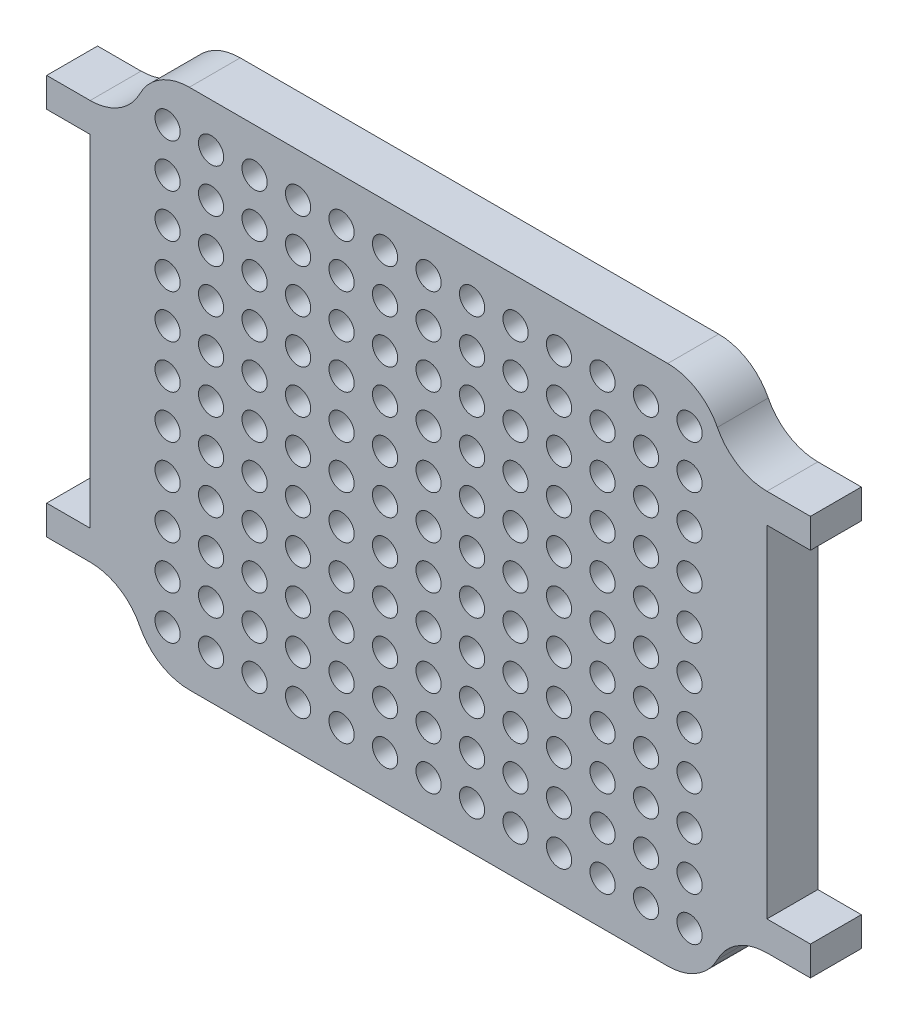
from build123d import *

# Parameters (mm, degrees)
SKETCH1_R           = 1.45
BOSS_EXTRUDE1_DEPTH = 5.85


with BuildPart() as part:
    # Sketch1 → Boss-Extrude1 (new body)
    with BuildSketch(Plane.XY):
        with BuildLine():
            Line((-38.9, 19.6), (-38.9, -19.6))
            Line((-38.9, -19.6), (-43.9, -19.6))
            Line((-43.9, -19.6), (-43.9, -22.98))
            Line((-43.9, -22.98), (-38.9, -22.98))
            ThreePointArc((-38.9, -22.98), (-35.552982671, -23.927877842), (-33.2, -26.49))
            ThreePointArc((-33.2, -26.49), (-30.847017329, -29.052122158), (-27.5, -30))
            Line((-27.5, -30), (27.5, -30))
            ThreePointArc((27.5, -30), (30.847017329, -29.052122158), (33.2, -26.49))
            ThreePointArc((33.2, -26.49), (35.552982671, -23.927877842), (38.9, -22.98))
            Line((38.9, -22.98), (43.9, -22.98))
            Line((43.9, -22.98), (43.9, -19.6))
            Line((43.9, -19.6), (38.9, -19.6))
            Line((38.9, -19.6), (38.9, 19.6))
            Line((38.9, 19.6), (43.9, 19.6))
            Line((43.9, 19.6), (43.9, 22.98))
            Line((43.9, 22.98), (38.9, 22.98))
            ThreePointArc((38.9, 22.98), (35.552982671, 23.927877842), (33.2, 26.49))
            ThreePointArc((33.2, 26.49), (30.847017329, 29.052122158), (27.5, 30))
            Line((27.5, 30), (-27.5, 30))
            ThreePointArc((-27.5, 30), (-30.847017329, 29.052122158), (-33.2, 26.49))
            ThreePointArc((-33.2, 26.49), (-35.552982671, 23.927877842), (-38.9, 22.98))
            Line((-38.9, 22.98), (-43.9, 22.98))
            Line((-43.9, 22.98), (-43.9, 19.6))
            Line((-43.9, 19.6), (-38.9, 19.6))
        make_face()
        with Locations((-30, 25)):
            Circle(SKETCH1_R, mode=Mode.SUBTRACT)
        with Locations((-25, 25)):
            Circle(SKETCH1_R, mode=Mode.SUBTRACT)
        with Locations((-20, 25)):
            Circle(SKETCH1_R, mode=Mode.SUBTRACT)
        with Locations((-15, 25)):
            Circle(SKETCH1_R, mode=Mode.SUBTRACT)
        with Locations((-10, 25)):
            Circle(SKETCH1_R, mode=Mode.SUBTRACT)
        with Locations((-5, 25)):
            Circle(SKETCH1_R, mode=Mode.SUBTRACT)
        with Locations((0, 25)):
            Circle(SKETCH1_R, mode=Mode.SUBTRACT)
        with Locations((5, 25)):
            Circle(SKETCH1_R, mode=Mode.SUBTRACT)
        with Locations((10, 25)):
            Circle(SKETCH1_R, mode=Mode.SUBTRACT)
        with Locations((15, 25)):
            Circle(SKETCH1_R, mode=Mode.SUBTRACT)
        with Locations((20, 25)):
            Circle(SKETCH1_R, mode=Mode.SUBTRACT)
        with Locations((25, 25)):
            Circle(SKETCH1_R, mode=Mode.SUBTRACT)
        with Locations((30, 25)):
            Circle(SKETCH1_R, mode=Mode.SUBTRACT)
        with Locations((-25, 20)):
            Circle(SKETCH1_R, mode=Mode.SUBTRACT)
        with Locations((-20, 20)):
            Circle(SKETCH1_R, mode=Mode.SUBTRACT)
        with Locations((-15, 20)):
            Circle(SKETCH1_R, mode=Mode.SUBTRACT)
        with Locations((-10, 20)):
            Circle(SKETCH1_R, mode=Mode.SUBTRACT)
        with Locations((-5, 20)):
            Circle(SKETCH1_R, mode=Mode.SUBTRACT)
        with Locations((0, 20)):
            Circle(SKETCH1_R, mode=Mode.SUBTRACT)
        with Locations((5, 20)):
            Circle(SKETCH1_R, mode=Mode.SUBTRACT)
        with Locations((10, 20)):
            Circle(SKETCH1_R, mode=Mode.SUBTRACT)
        with Locations((15, 20)):
            Circle(SKETCH1_R, mode=Mode.SUBTRACT)
        with Locations((20, 20)):
            Circle(SKETCH1_R, mode=Mode.SUBTRACT)
        with Locations((25, 20)):
            Circle(SKETCH1_R, mode=Mode.SUBTRACT)
        with Locations((30, 20)):
            Circle(SKETCH1_R, mode=Mode.SUBTRACT)
        with Locations((-25, 15)):
            Circle(SKETCH1_R, mode=Mode.SUBTRACT)
        with Locations((-20, 15)):
            Circle(SKETCH1_R, mode=Mode.SUBTRACT)
        with Locations((-15, 15)):
            Circle(SKETCH1_R, mode=Mode.SUBTRACT)
        with Locations((-10, 15)):
            Circle(SKETCH1_R, mode=Mode.SUBTRACT)
        with Locations((-5, 15)):
            Circle(SKETCH1_R, mode=Mode.SUBTRACT)
        with Locations((0, 15)):
            Circle(SKETCH1_R, mode=Mode.SUBTRACT)
        with Locations((5, 15)):
            Circle(SKETCH1_R, mode=Mode.SUBTRACT)
        with Locations((10, 15)):
            Circle(SKETCH1_R, mode=Mode.SUBTRACT)
        with Locations((15, 15)):
            Circle(SKETCH1_R, mode=Mode.SUBTRACT)
        with Locations((20, 15)):
            Circle(SKETCH1_R, mode=Mode.SUBTRACT)
        with Locations((25, 15)):
            Circle(SKETCH1_R, mode=Mode.SUBTRACT)
        with Locations((30, 15)):
            Circle(SKETCH1_R, mode=Mode.SUBTRACT)
        with Locations((-25, 10)):
            Circle(SKETCH1_R, mode=Mode.SUBTRACT)
        with Locations((-20, 10)):
            Circle(SKETCH1_R, mode=Mode.SUBTRACT)
        with Locations((-15, 10)):
            Circle(SKETCH1_R, mode=Mode.SUBTRACT)
        with Locations((-10, 10)):
            Circle(SKETCH1_R, mode=Mode.SUBTRACT)
        with Locations((-5, 10)):
            Circle(SKETCH1_R, mode=Mode.SUBTRACT)
        with Locations((0, 10)):
            Circle(SKETCH1_R, mode=Mode.SUBTRACT)
        with Locations((5, 10)):
            Circle(SKETCH1_R, mode=Mode.SUBTRACT)
        with Locations((10, 10)):
            Circle(SKETCH1_R, mode=Mode.SUBTRACT)
        with Locations((15, 10)):
            Circle(SKETCH1_R, mode=Mode.SUBTRACT)
        with Locations((20, 10)):
            Circle(SKETCH1_R, mode=Mode.SUBTRACT)
        with Locations((25, 10)):
            Circle(SKETCH1_R, mode=Mode.SUBTRACT)
        with Locations((30, 10)):
            Circle(SKETCH1_R, mode=Mode.SUBTRACT)
        with Locations((-25, 5)):
            Circle(SKETCH1_R, mode=Mode.SUBTRACT)
        with Locations((-20, 5)):
            Circle(SKETCH1_R, mode=Mode.SUBTRACT)
        with Locations((-15, 5)):
            Circle(SKETCH1_R, mode=Mode.SUBTRACT)
        with Locations((-10, 5)):
            Circle(SKETCH1_R, mode=Mode.SUBTRACT)
        with Locations((-5, 5)):
            Circle(SKETCH1_R, mode=Mode.SUBTRACT)
        with Locations((0, 5)):
            Circle(SKETCH1_R, mode=Mode.SUBTRACT)
        with Locations((5, 5)):
            Circle(SKETCH1_R, mode=Mode.SUBTRACT)
        with Locations((10, 5)):
            Circle(SKETCH1_R, mode=Mode.SUBTRACT)
        with Locations((15, 5)):
            Circle(SKETCH1_R, mode=Mode.SUBTRACT)
        with Locations((20, 5)):
            Circle(SKETCH1_R, mode=Mode.SUBTRACT)
        with Locations((25, 5)):
            Circle(SKETCH1_R, mode=Mode.SUBTRACT)
        with Locations((30, 5)):
            Circle(SKETCH1_R, mode=Mode.SUBTRACT)
        with Locations((-25, 0)):
            Circle(SKETCH1_R, mode=Mode.SUBTRACT)
        with Locations((-20, 0)):
            Circle(SKETCH1_R, mode=Mode.SUBTRACT)
        with Locations((-15, 0)):
            Circle(SKETCH1_R, mode=Mode.SUBTRACT)
        with Locations((-10, 0)):
            Circle(SKETCH1_R, mode=Mode.SUBTRACT)
        with Locations((-5, 0)):
            Circle(SKETCH1_R, mode=Mode.SUBTRACT)
        Circle(SKETCH1_R, mode=Mode.SUBTRACT)
        with Locations((5, 0)):
            Circle(SKETCH1_R, mode=Mode.SUBTRACT)
        with Locations((10, 0)):
            Circle(SKETCH1_R, mode=Mode.SUBTRACT)
        with Locations((15, 0)):
            Circle(SKETCH1_R, mode=Mode.SUBTRACT)
        with Locations((20, 0)):
            Circle(SKETCH1_R, mode=Mode.SUBTRACT)
        with Locations((25, 0)):
            Circle(SKETCH1_R, mode=Mode.SUBTRACT)
        with Locations((30, 0)):
            Circle(SKETCH1_R, mode=Mode.SUBTRACT)
        with Locations((-25, -5)):
            Circle(SKETCH1_R, mode=Mode.SUBTRACT)
        with Locations((-20, -5)):
            Circle(SKETCH1_R, mode=Mode.SUBTRACT)
        with Locations((-15, -5)):
            Circle(SKETCH1_R, mode=Mode.SUBTRACT)
        with Locations((-10, -5)):
            Circle(SKETCH1_R, mode=Mode.SUBTRACT)
        with Locations((-5, -5)):
            Circle(SKETCH1_R, mode=Mode.SUBTRACT)
        with Locations((0, -5)):
            Circle(SKETCH1_R, mode=Mode.SUBTRACT)
        with Locations((5, -5)):
            Circle(SKETCH1_R, mode=Mode.SUBTRACT)
        with Locations((10, -5)):
            Circle(SKETCH1_R, mode=Mode.SUBTRACT)
        with Locations((15, -5)):
            Circle(SKETCH1_R, mode=Mode.SUBTRACT)
        with Locations((20, -5)):
            Circle(SKETCH1_R, mode=Mode.SUBTRACT)
        with Locations((25, -5)):
            Circle(SKETCH1_R, mode=Mode.SUBTRACT)
        with Locations((30, -5)):
            Circle(SKETCH1_R, mode=Mode.SUBTRACT)
        with Locations((-25, -10)):
            Circle(SKETCH1_R, mode=Mode.SUBTRACT)
        with Locations((-20, -10)):
            Circle(SKETCH1_R, mode=Mode.SUBTRACT)
        with Locations((-15, -10)):
            Circle(SKETCH1_R, mode=Mode.SUBTRACT)
        with Locations((-10, -10)):
            Circle(SKETCH1_R, mode=Mode.SUBTRACT)
        with Locations((-5, -10)):
            Circle(SKETCH1_R, mode=Mode.SUBTRACT)
        with Locations((0, -10)):
            Circle(SKETCH1_R, mode=Mode.SUBTRACT)
        with Locations((5, -10)):
            Circle(SKETCH1_R, mode=Mode.SUBTRACT)
        with Locations((10, -10)):
            Circle(SKETCH1_R, mode=Mode.SUBTRACT)
        with Locations((15, -10)):
            Circle(SKETCH1_R, mode=Mode.SUBTRACT)
        with Locations((20, -10)):
            Circle(SKETCH1_R, mode=Mode.SUBTRACT)
        with Locations((25, -10)):
            Circle(SKETCH1_R, mode=Mode.SUBTRACT)
        with Locations((30, -10)):
            Circle(SKETCH1_R, mode=Mode.SUBTRACT)
        with Locations((-25, -15)):
            Circle(SKETCH1_R, mode=Mode.SUBTRACT)
        with Locations((-20, -15)):
            Circle(SKETCH1_R, mode=Mode.SUBTRACT)
        with Locations((-15, -15)):
            Circle(SKETCH1_R, mode=Mode.SUBTRACT)
        with Locations((-10, -15)):
            Circle(SKETCH1_R, mode=Mode.SUBTRACT)
        with Locations((-5, -15)):
            Circle(SKETCH1_R, mode=Mode.SUBTRACT)
        with Locations((0, -15)):
            Circle(SKETCH1_R, mode=Mode.SUBTRACT)
        with Locations((5, -15)):
            Circle(SKETCH1_R, mode=Mode.SUBTRACT)
        with Locations((10, -15)):
            Circle(SKETCH1_R, mode=Mode.SUBTRACT)
        with Locations((15, -15)):
            Circle(SKETCH1_R, mode=Mode.SUBTRACT)
        with Locations((20, -15)):
            Circle(SKETCH1_R, mode=Mode.SUBTRACT)
        with Locations((25, -15)):
            Circle(SKETCH1_R, mode=Mode.SUBTRACT)
        with Locations((30, -15)):
            Circle(SKETCH1_R, mode=Mode.SUBTRACT)
        with Locations((-25, -20)):
            Circle(SKETCH1_R, mode=Mode.SUBTRACT)
        with Locations((-20, -20)):
            Circle(SKETCH1_R, mode=Mode.SUBTRACT)
        with Locations((-15, -20)):
            Circle(SKETCH1_R, mode=Mode.SUBTRACT)
        with Locations((-10, -20)):
            Circle(SKETCH1_R, mode=Mode.SUBTRACT)
        with Locations((-5, -20)):
            Circle(SKETCH1_R, mode=Mode.SUBTRACT)
        with Locations((0, -20)):
            Circle(SKETCH1_R, mode=Mode.SUBTRACT)
        with Locations((5, -20)):
            Circle(SKETCH1_R, mode=Mode.SUBTRACT)
        with Locations((10, -20)):
            Circle(SKETCH1_R, mode=Mode.SUBTRACT)
        with Locations((15, -20)):
            Circle(SKETCH1_R, mode=Mode.SUBTRACT)
        with Locations((20, -20)):
            Circle(SKETCH1_R, mode=Mode.SUBTRACT)
        with Locations((25, -20)):
            Circle(SKETCH1_R, mode=Mode.SUBTRACT)
        with Locations((30, -20)):
            Circle(SKETCH1_R, mode=Mode.SUBTRACT)
        with Locations((-25, -25)):
            Circle(SKETCH1_R, mode=Mode.SUBTRACT)
        with Locations((-20, -25)):
            Circle(SKETCH1_R, mode=Mode.SUBTRACT)
        with Locations((-15, -25)):
            Circle(SKETCH1_R, mode=Mode.SUBTRACT)
        with Locations((-10, -25)):
            Circle(SKETCH1_R, mode=Mode.SUBTRACT)
        with Locations((-5, -25)):
            Circle(SKETCH1_R, mode=Mode.SUBTRACT)
        with Locations((0, -25)):
            Circle(SKETCH1_R, mode=Mode.SUBTRACT)
        with Locations((5, -25)):
            Circle(SKETCH1_R, mode=Mode.SUBTRACT)
        with Locations((10, -25)):
            Circle(SKETCH1_R, mode=Mode.SUBTRACT)
        with Locations((15, -25)):
            Circle(SKETCH1_R, mode=Mode.SUBTRACT)
        with Locations((20, -25)):
            Circle(SKETCH1_R, mode=Mode.SUBTRACT)
        with Locations((25, -25)):
            Circle(SKETCH1_R, mode=Mode.SUBTRACT)
        with Locations((30, -25)):
            Circle(SKETCH1_R, mode=Mode.SUBTRACT)
        with Locations((-30, 20)):
            Circle(SKETCH1_R, mode=Mode.SUBTRACT)
        with Locations((-30, 15)):
            Circle(SKETCH1_R, mode=Mode.SUBTRACT)
        with Locations((-30, 10)):
            Circle(SKETCH1_R, mode=Mode.SUBTRACT)
        with Locations((-30, 5)):
            Circle(SKETCH1_R, mode=Mode.SUBTRACT)
        with Locations((-30, 0)):
            Circle(SKETCH1_R, mode=Mode.SUBTRACT)
        with Locations((-30, -5)):
            Circle(SKETCH1_R, mode=Mode.SUBTRACT)
        with Locations((-30, -10)):
            Circle(SKETCH1_R, mode=Mode.SUBTRACT)
        with Locations((-30, -15)):
            Circle(SKETCH1_R, mode=Mode.SUBTRACT)
        with Locations((-30, -20)):
            Circle(SKETCH1_R, mode=Mode.SUBTRACT)
        with Locations((-30, -25)):
            Circle(SKETCH1_R, mode=Mode.SUBTRACT)
    extrude(amount=BOSS_EXTRUDE1_DEPTH)


solid = part.part
